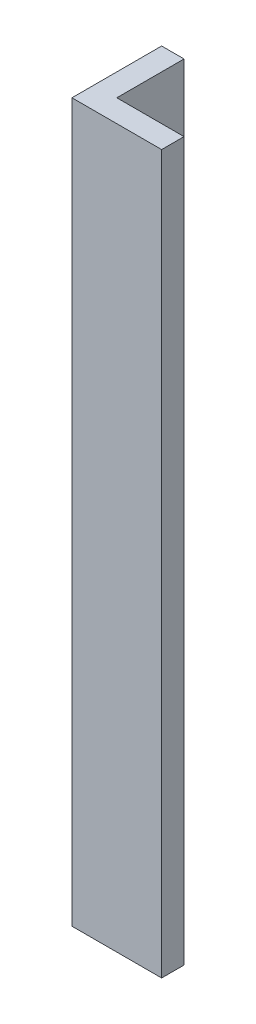
from build123d import *

# Parameters (mm, degrees)
BOSS_EXTRUDE1_DEPTH = 50.8


with BuildPart() as part:
    # Sketch1 → Boss-Extrude1 (new body)
    with BuildSketch(Plane(origin=(0, 0, 0), x_dir=(1, 0, 0), z_dir=(0, 1, 0))):
        Polygon((0, 0), (6.35, 0), (6.35, 1.5875), (1.5875, 1.5875), (1.5875, 6.35), (0, 6.35), align=None)
    extrude(amount=BOSS_EXTRUDE1_DEPTH)


solid = part.part
